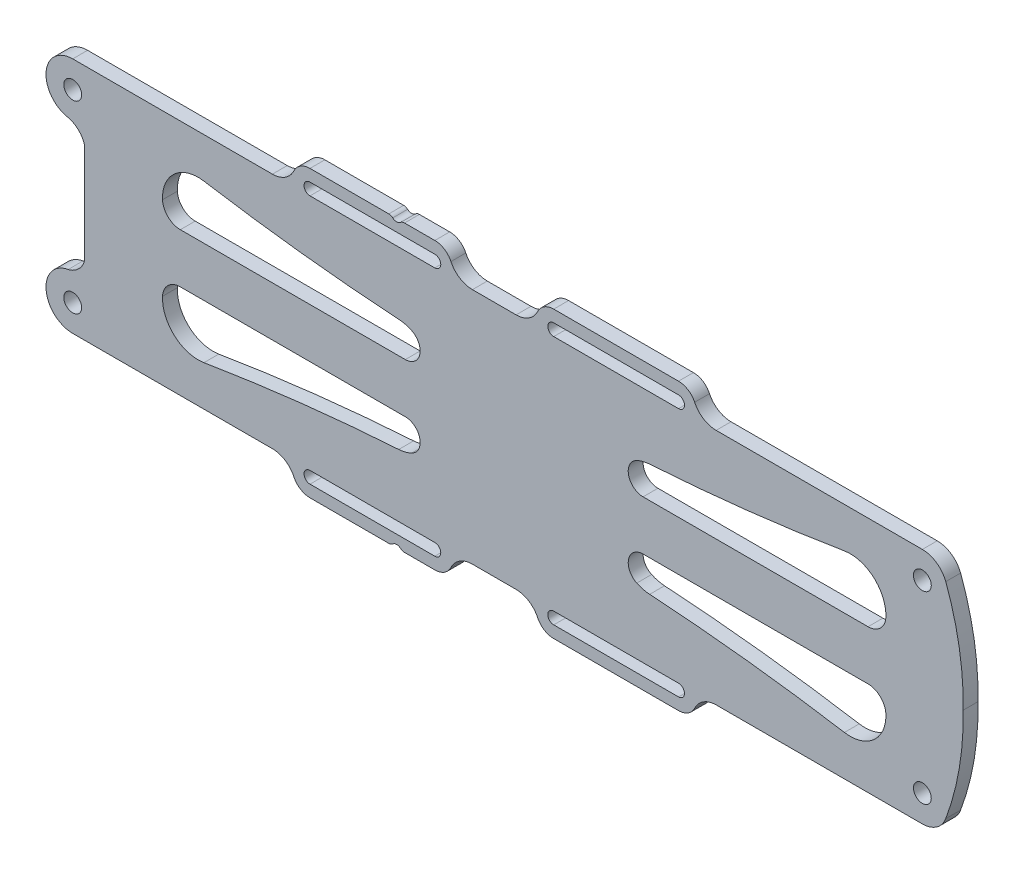
from build123d import *

# Parameters (mm, degrees)
CROQUIS1_R              = 1.5
SALIENTE_EXTRUIR1_DEPTH = 2.5


with BuildPart() as part:
    # Croquis1 → Saliente-Extruir1 (new body)
    with BuildSketch(Plane.XY):
        with BuildLine():
            Line((-1.727869, -20), (-35.318076, -20))
            ThreePointArc((-35.318076, -20), (-39.801686502, -15.883714562), (-36.082710062, -11.065438607))
            add(Edge.make_bspline(
                [(-36.082710062, -11.065438607), (-34.968163592, -10.873261807), (-33.318075526, -9.571810644), (-33.318075526, -8.000000003)],
                knots=[0, 0, 0, 0, 1, 1, 1, 1], degree=3))
            Line((-33.318075526, -8.000000003), (-33.318076, 0))
            Line((-33.318076, 0), (-33.318075526, 7.999999997))
            add(Edge.make_bspline(
                [(-36.082710062, 11.065438607), (-34.968163592, 10.873261801), (-33.318075526, 9.571810638), (-33.318075526, 7.999999997)],
                knots=[0, 0, 0, 0, 1, 1, 1, 1], degree=3))
            ThreePointArc((-36.082710062, 11.065438607), (-39.801686502, 15.883714562), (-35.318076, 20))
            Line((-35.318076, 20), (-1.727869, 20))
            ThreePointArc((-1.727869, 20), (0.410220921, 20.619382972), (1.886162597, 22.285714256))
            ThreePointArc((1.886162597, 22.285714256), (2.993118801, 23.535462608), (4.596686131, 23.999999793))
            Line((4.596686131, 23.999999793), (17.855013131, 23.999999793))
            ThreePointArc((17.855013131, 23.999999793), (18.20856652, 23.93541414), (18.516450957, 23.749999795))
            ThreePointArc((18.516450957, 23.749999795), (19.177888957, 23.499999641), (19.839326957, 23.749999792))
            ThreePointArc((19.839326957, 23.749999792), (20.147211189, 23.935413861), (20.500764274, 23.999999414))
            Line((20.500764274, 23.999999414), (25.596686274, 23.999999414))
            ThreePointArc((25.596686274, 23.999999414), (27.200253319, 23.535462249), (28.307209321, 22.285714093))
            ThreePointArc((28.307209321, 22.285714093), (29.783150997, 20.61938281), (31.921240919, 19.999999837))
            Line((31.921240919, 19.999999837), (39.272130919, 19.999999837))
            ThreePointArc((39.272130919, 19.999999837), (41.41022084, 20.61938281), (42.886162516, 22.285714093))
            ThreePointArc((42.886162516, 22.285714093), (43.993118719, 23.535462445), (45.596686049, 23.999999631))
            Line((45.596686049, 23.999999631), (66.596686049, 23.999999631))
            ThreePointArc((66.596686049, 23.999999631), (68.20025338, 23.535462445), (69.307209583, 22.285714093))
            ThreePointArc((69.307209583, 22.285714093), (70.783151259, 20.61938281), (72.92124118, 19.999999837))
            Line((72.92124118, 19.999999837), (107.61258818, 19.999999837))
            ThreePointArc((107.61258818, 19.999999837), (110.006914096, 19.249811631), (111.545093682, 17.267494173))
            ThreePointArc((111.545093682, 17.267494173), (113.827321184, 8.772458491), (114.473968889, -7.06e-07))
            ThreePointArc((114.473968889, -7.06e-07), (113.827321261, -8.772459139), (111.545094118, -17.267494122))
            ThreePointArc((111.545094118, -17.267494122), (110.006914516, -19.249811879), (107.612588369, -20.000000175))
            Line((107.612588369, -20.000000175), (72.921241369, -20.000000175))
            ThreePointArc((72.921241369, -20.000000175), (70.783151447, -20.619383147), (69.307209771, -22.285714431))
            ThreePointArc((69.307209771, -22.285714431), (68.200253515, -23.535462843), (66.596686107, -24.000000051))
            Line((66.596686107, -24.000000051), (45.596686107, -24.000000051))
            ThreePointArc((45.596686107, -24.000000051), (43.993118827, -23.535462721), (42.886162705, -22.285714307))
            ThreePointArc((42.886162705, -22.285714307), (41.410221028, -20.619383023), (39.272131107, -20.000000051))
            Line((39.272131107, -20.000000051), (31.921241107, -20.000000051))
            ThreePointArc((31.921241107, -20.000000051), (29.783151186, -20.619383023), (28.30720951, -22.285714307))
            ThreePointArc((28.30720951, -22.285714307), (27.200253316, -23.535462648), (25.596686, -23.999999829))
            Line((25.596686, -23.999999829), (20.500764, -23.999999829))
            ThreePointArc((20.500764, -23.999999829), (20.14721061, -23.935414176), (19.839326174, -23.74999983))
            ThreePointArc((19.839326174, -23.74999983), (19.177888468, -23.50000009), (18.516450826, -23.750000001))
            ThreePointArc((18.516450826, -23.750000001), (18.20856639, -23.935414347), (17.855013, -24))
            Line((17.855013, -24), (4.596686, -24))
            ThreePointArc((4.596686, -24), (2.993118559, -23.535462771), (1.886162302, -22.285714308))
            ThreePointArc((1.886162302, -22.285714308), (0.410220761, -20.619383073), (-1.727869, -20))
        make_face()
        with Locations((107.612588, -15.5)):
            Circle(CROQUIS1_R, mode=Mode.SUBTRACT)
        with Locations((-35.318076, -15.5)):
            Circle(CROQUIS1_R, mode=Mode.SUBTRACT)
        with Locations((-35.318076, 15.5)):
            Circle(CROQUIS1_R, mode=Mode.SUBTRACT)
        with Locations((107.612588, 15.5)):
            Circle(CROQUIS1_R, mode=Mode.SUBTRACT)
        with BuildLine():
            Line((66.596686049, 19.999999775), (45.596686049, 19.999999775))
            ThreePointArc((45.596686049, 19.999999775), (44.596686049, 20.999999775), (45.596686049, 21.999999775))
            Line((45.596686049, 21.999999775), (66.596686049, 21.999999775))
            ThreePointArc((66.596686049, 21.999999775), (67.596686049, 20.999999775), (66.596686049, 19.999999775))
        make_face(mode=Mode.SUBTRACT)
        with BuildLine():
            Line((4.596686131, 21.999999938), (25.596686131, 21.999999938))
            ThreePointArc((25.596686131, 21.999999938), (26.596686131, 20.999999938), (25.596686131, 19.999999938))
            Line((25.596686131, 19.999999938), (4.596686131, 19.999999938))
            ThreePointArc((4.596686131, 19.999999938), (3.596686131, 20.999999938), (4.596686131, 21.999999938))
        make_face(mode=Mode.SUBTRACT)
        with BuildLine():
            Line((60.629579, -4.165983), (98.473924, -4.165983))
            ThreePointArc((98.473924, -4.165983), (100.546598144, -4.997118122), (101.470828647, -7.029988427))
            ThreePointArc((101.470828647, -7.029988427), (99.46254802, -11.787003007), (94.502482097, -13.222316504))
            ThreePointArc((94.502482097, -13.222316504), (78.165345659, -10.947800594), (61.735508446, -9.48632916))
            ThreePointArc((61.735508446, -9.48632916), (60.624439263, -9.309527068), (59.565908087, -8.928416245))
            ThreePointArc((59.565908087, -8.928416245), (58.189693438, -6.121044064), (60.629579, -4.165983))
        make_face(mode=Mode.SUBTRACT)
        with BuildLine():
            Line((25.596686, -20), (4.596686, -20))
            ThreePointArc((4.596686, -20), (3.596686, -21), (4.596686, -22))
            Line((4.596686, -22), (25.596686, -22))
            ThreePointArc((25.596686, -22), (26.596686, -21), (25.596686, -20))
        make_face(mode=Mode.SUBTRACT)
        with BuildLine():
            Line((66.596686107, -20.000000051), (45.596686107, -20.000000051))
            ThreePointArc((45.596686107, -20.000000051), (44.596686427, -21.000000051), (45.596686107, -22.000000051))
            Line((45.596686107, -22.000000051), (66.596686107, -22.000000051))
            ThreePointArc((66.596686107, -22.000000051), (67.596686107, -21.000000051), (66.596686107, -20.000000051))
        make_face(mode=Mode.SUBTRACT)
        with BuildLine():
            Line((20.630693, -4.165983), (-17.213652, -4.165983))
            ThreePointArc((-17.213652, -4.165983), (-19.286331958, -4.997112835), (-20.210567815, -7.029984473))
            ThreePointArc((-20.210567815, -7.029984473), (-18.202285238, -11.787004738), (-13.242211847, -13.222314))
            ThreePointArc((-13.242211847, -13.222314), (3.094925006, -10.947797585), (19.524762662, -9.486325691))
            ThreePointArc((19.524762662, -9.486325691), (20.635832812, -9.309527332), (21.694365632, -8.928419991))
            ThreePointArc((21.694365632, -8.928419991), (23.070588154, -6.121043634), (20.630693, -4.165983))
        make_face(mode=Mode.SUBTRACT)
        with BuildLine():
            Line((60.629579, 4.165983), (98.473924, 4.165983))
            ThreePointArc((98.473924, 4.165983), (100.546603429, 4.997112019), (101.470840047, 7.029982437))
            ThreePointArc((101.470840047, 7.029982437), (99.462556799, 11.787003808), (94.502482022, 13.222312881))
            ThreePointArc((94.502482022, 13.222312881), (78.165344631, 10.947798744), (61.735506549, 9.486329166))
            ThreePointArc((61.735506549, 9.486329166), (60.624437652, 9.309528853), (59.565906368, 8.928419991))
            ThreePointArc((59.565906368, 8.928419991), (58.189683846, 6.121043634), (60.629579, 4.165983))
        make_face(mode=Mode.SUBTRACT)
        with BuildLine():
            Line((20.630693, 4.165983), (-17.213652, 4.165983))
            ThreePointArc((-17.213652, 4.165983), (-19.286325559, 4.99711656), (-20.210557539, 7.029984958))
            ThreePointArc((-20.210557539, 7.029984958), (-18.202276912, 11.786999538), (-13.242210989, 13.222313035))
            ThreePointArc((-13.242210989, 13.222313035), (3.094925937, 10.947798842), (19.524763554, 9.48632916))
            ThreePointArc((19.524763554, 9.48632916), (20.635832737, 9.309527068), (21.694363913, 8.928416245))
            ThreePointArc((21.694363913, 8.928416245), (23.070578562, 6.121044064), (20.630693, 4.165983))
        make_face(mode=Mode.SUBTRACT)
    extrude(amount=SALIENTE_EXTRUIR1_DEPTH)


solid = part.part
